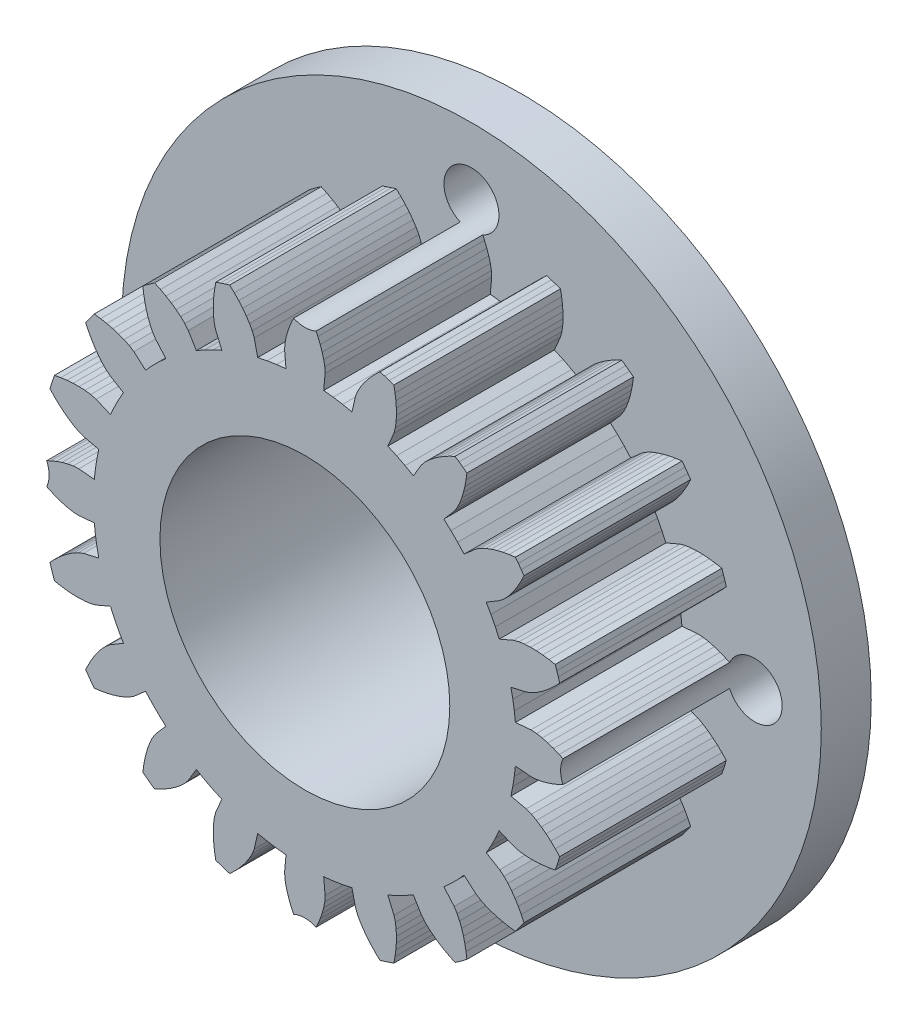
from build123d import *

# Parameters (mm, degrees)
SUN_TEETH_START     = 30
SKETCH_1_R          = 8.7
SUN_TEETH_DEPTH     = 10
SUN_FLANGE_START    = 27
SKETCH_2_R          = 21
SKETCH_2_R_2        = 8.7
SUN_FLANGE_DEPTH    = 3
SKETCH_3_R          = 1.65
THROUGH_HOLES_DEPTH = 100


with BuildPart() as part:
    # Эскиз1 → Sun_teeth (new body)
    with BuildSketch(Plane.XY.offset(SUN_TEETH_START)):
        Polygon((12.636938344, -1.131567732), (13.571243099, -1.21522954), (13.90631459, -1.195509775), (14.24468064, -1.133068514), (14.584638429, -1.040946263), (14.925265343, -0.923424492), (15.265811742, -0.782812918), (15.605600595, -0.620576184), (15.943992279, -0.437733022), (15.949332438, -0.145927294), (15.949332438, 0.145927294), (15.943992279, 0.437733022), (15.605600595, 0.620576184), (15.265811742, 0.782812918), (14.925265343, 0.923424492), (14.584638429, 1.040946263), (14.24468064, 1.133068514), (13.90631459, 1.195509775), (13.571243099, 1.21522954), (12.636938344, 1.131567732), (12.57293242, 1.701183884), (12.483264038, 2.267327769), (12.368116218, 2.82884384), (13.282545763, 3.037992779), (13.595123946, 3.160290176), (13.897633772, 3.324236204), (14.192485501, 3.516902405), (14.480124723, 3.733931756), (14.760552229, 3.972895934), (15.033576724, 4.232192768), (15.298904696, 4.51065573), (15.21381056, 4.789829669), (15.123622532, 5.067399876), (15.02837081, 5.343273415), (14.65003955, 5.412598815), (14.276747238, 5.461894588), (13.909417001, 5.490389517), (13.54914533, 5.496899858), (13.197358919, 5.479460591), (12.856258271, 5.434284899), (12.531492603, 5.349496726), (11.668768899, 4.981213571), (11.431874577, 5.503171805), (11.171646795, 6.013897582), (10.888616702, 6.512348467), (11.693660304, 6.993835198), (11.953147847, 7.206738905), (12.19018968, 7.456141521), (12.411073208, 7.730492162), (12.617568607, 8.025784748), (12.810427021, 8.339710052), (12.989961618, 8.670685204), (13.156253727, 9.017510071), (12.989054903, 9.256724731), (12.81750708, 9.492840052), (12.641667697, 9.725776978), (12.26043056, 9.674798562), (11.890175244, 9.60632796), (11.53201801, 9.519916963), (11.187367484, 9.414778596), (10.858187755, 9.289484888), (10.547741818, 9.141114354), (10.2650723, 8.960117899), (9.558379052, 8.343263519), (9.171785199, 8.766470927), (8.766470927, 9.171785199), (8.343263519, 9.558379052), (8.960117899, 10.2650723), (9.141114354, 10.547741818), (9.289484888, 10.858187755), (9.414778596, 11.187367484), (9.519916963, 11.53201801), (9.60632796, 11.890175244), (9.674798562, 12.26043056), (9.725776978, 12.641667697), (9.492840052, 12.81750708), (9.256724731, 12.989054903), (9.017510071, 13.156253727), (8.670685204, 12.989961618), (8.339710052, 12.810427021), (8.025784748, 12.617568607), (7.730492162, 12.411073208), (7.456141521, 12.19018968), (7.206738905, 11.953147847), (6.993835198, 11.693660304), (6.512348467, 10.888616702), (6.013897582, 11.171646795), (5.503171805, 11.431874577), (4.981213571, 11.668768899), (5.349496726, 12.531492603), (5.434284899, 12.856258271), (5.479460591, 13.197358919), (5.496899858, 13.54914533), (5.490389517, 13.909417001), (5.461894588, 14.276747238), (5.412598815, 14.65003955), (5.343273415, 15.02837081), (5.067399876, 15.123622532), (4.789829669, 15.21381056), (4.51065573, 15.298904696), (4.232192768, 15.033576724), (3.972895934, 14.760552229), (3.733931756, 14.480124723), (3.516902405, 14.192485501), (3.324236204, 13.897633772), (3.160290176, 13.595123946), (3.037992779, 13.282545763), (2.82884384, 12.368116218), (2.267327769, 12.483264038), (1.701183884, 12.57293242), (1.131567732, 12.636938344), (1.21522954, 13.571243099), (1.195509775, 13.90631459), (1.133068514, 14.24468064), (1.040946263, 14.584638429), (0.923424492, 14.925265343), (0.782812918, 15.265811742), (0.620576184, 15.605600595), (0.437733022, 15.943992279), (0.145927294, 15.949332438), (-0.145927294, 15.949332438), (-0.437733022, 15.943992279), (-0.620576184, 15.605600595), (-0.782812918, 15.265811742), (-0.923424492, 14.925265343), (-1.040946263, 14.584638429), (-1.133068514, 14.24468064), (-1.195509775, 13.90631459), (-1.21522954, 13.571243099), (-1.131567732, 12.636938344), (-1.701183884, 12.57293242), (-2.267327769, 12.483264038), (-2.82884384, 12.368116218), (-3.037992779, 13.282545763), (-3.160290176, 13.595123946), (-3.324236204, 13.897633772), (-3.516902405, 14.192485501), (-3.733931756, 14.480124723), (-3.972895934, 14.760552229), (-4.232192768, 15.033576724), (-4.51065573, 15.298904696), (-4.789829669, 15.21381056), (-5.067399876, 15.123622532), (-5.343273415, 15.02837081), (-5.412598815, 14.65003955), (-5.461894588, 14.276747238), (-5.490389517, 13.909417001), (-5.496899858, 13.54914533), (-5.479460591, 13.197358919), (-5.434284899, 12.856258271), (-5.349496726, 12.531492603), (-4.981213571, 11.668768899), (-5.503171805, 11.431874577), (-6.013897582, 11.171646795), (-6.512348467, 10.888616702), (-6.993835198, 11.693660304), (-7.206738905, 11.953147847), (-7.456141521, 12.19018968), (-7.730492162, 12.411073208), (-8.025784748, 12.617568607), (-8.339710052, 12.810427021), (-8.670685204, 12.989961618), (-9.017510071, 13.156253727), (-9.256724731, 12.989054903), (-9.492840052, 12.81750708), (-9.725776978, 12.641667697), (-9.674798562, 12.26043056), (-9.60632796, 11.890175244), (-9.519916963, 11.53201801), (-9.414778596, 11.187367484), (-9.289484888, 10.858187755), (-9.141114354, 10.547741818), (-8.960117899, 10.2650723), (-8.343263519, 9.558379052), (-8.766470927, 9.171785199), (-9.171785199, 8.766470927), (-9.558379052, 8.343263519), (-10.2650723, 8.960117899), (-10.547741818, 9.141114354), (-10.858187755, 9.289484888), (-11.187367484, 9.414778596), (-11.53201801, 9.519916963), (-11.890175244, 9.60632796), (-12.26043056, 9.674798562), (-12.641667697, 9.725776978), (-12.81750708, 9.492840052), (-12.989054903, 9.256724731), (-13.156253727, 9.017510071), (-12.989961618, 8.670685204), (-12.810427021, 8.339710052), (-12.617568607, 8.025784748), (-12.411073208, 7.730492162), (-12.19018968, 7.456141521), (-11.953147847, 7.206738905), (-11.693660304, 6.993835198), (-10.888616702, 6.512348467), (-11.171646795, 6.013897582), (-11.431874577, 5.503171805), (-11.668768899, 4.981213571), (-12.531492603, 5.349496726), (-12.856258271, 5.434284899), (-13.197358919, 5.479460591), (-13.54914533, 5.496899858), (-13.909417001, 5.490389517), (-14.276747238, 5.461894588), (-14.65003955, 5.412598815), (-15.02837081, 5.343273415), (-15.123622532, 5.067399876), (-15.21381056, 4.789829669), (-15.298904696, 4.51065573), (-15.033576724, 4.232192768), (-14.760552229, 3.972895934), (-14.480124723, 3.733931756), (-14.192485501, 3.516902405), (-13.897633772, 3.324236204), (-13.595123946, 3.160290176), (-13.282545763, 3.037992779), (-12.368116218, 2.82884384), (-12.483264038, 2.267327769), (-12.57293242, 1.701183884), (-12.636938344, 1.131567732), (-13.571243099, 1.21522954), (-13.90631459, 1.195509775), (-14.24468064, 1.133068514), (-14.584638429, 1.040946263), (-14.925265343, 0.923424492), (-15.265811742, 0.782812918), (-15.605600595, 0.620576184), (-15.943992279, 0.437733022), (-15.949332438, 0.145927294), (-15.949332438, -0.145927294), (-15.943992279, -0.437733022), (-15.605600595, -0.620576184), (-15.265811742, -0.782812918), (-14.925265343, -0.923424492), (-14.584638429, -1.040946263), (-14.24468064, -1.133068514), (-13.90631459, -1.195509775), (-13.571243099, -1.21522954), (-12.636938344, -1.131567732), (-12.57293242, -1.701183884), (-12.483264038, -2.267327769), (-12.368116218, -2.82884384), (-13.282545763, -3.037992779), (-13.595123946, -3.160290176), (-13.897633772, -3.324236204), (-14.192485501, -3.516902405), (-14.480124723, -3.733931756), (-14.760552229, -3.972895934), (-15.033576724, -4.232192768), (-15.298904696, -4.51065573), (-15.21381056, -4.789829669), (-15.123622532, -5.067399876), (-15.02837081, -5.343273415), (-14.65003955, -5.412598815), (-14.276747238, -5.461894588), (-13.909417001, -5.490389517), (-13.54914533, -5.496899858), (-13.197358919, -5.479460591), (-12.856258271, -5.434284899), (-12.531492603, -5.349496726), (-11.668768899, -4.981213571), (-11.431874577, -5.503171805), (-11.171646795, -6.013897582), (-10.888616702, -6.512348467), (-11.693660304, -6.993835198), (-11.953147847, -7.206738905), (-12.19018968, -7.456141521), (-12.411073208, -7.730492162), (-12.617568607, -8.025784748), (-12.810427021, -8.339710052), (-12.989961618, -8.670685204), (-13.156253727, -9.017510071), (-12.989054903, -9.256724731), (-12.81750708, -9.492840052), (-12.641667697, -9.725776978), (-12.26043056, -9.674798562), (-11.890175244, -9.60632796), (-11.53201801, -9.519916963), (-11.187367484, -9.414778596), (-10.858187755, -9.289484888), (-10.547741818, -9.141114354), (-10.2650723, -8.960117899), (-9.558379052, -8.343263519), (-9.171785199, -8.766470927), (-8.766470927, -9.171785199), (-8.343263519, -9.558379052), (-8.960117899, -10.2650723), (-9.141114354, -10.547741818), (-9.289484888, -10.858187755), (-9.414778596, -11.187367484), (-9.519916963, -11.53201801), (-9.60632796, -11.890175244), (-9.674798562, -12.26043056), (-9.725776978, -12.641667697), (-9.492840052, -12.81750708), (-9.256724731, -12.989054903), (-9.017510071, -13.156253727), (-8.670685204, -12.989961618), (-8.339710052, -12.810427021), (-8.025784748, -12.617568607), (-7.730492162, -12.411073208), (-7.456141521, -12.19018968), (-7.206738905, -11.953147847), (-6.993835198, -11.693660304), (-6.512348467, -10.888616702), (-6.013897582, -11.171646795), (-5.503171805, -11.431874577), (-4.981213571, -11.668768899), (-5.349496726, -12.531492603), (-5.434284899, -12.856258271), (-5.479460591, -13.197358919), (-5.496899858, -13.54914533), (-5.490389517, -13.909417001), (-5.461894588, -14.276747238), (-5.412598815, -14.65003955), (-5.343273415, -15.02837081), (-5.067399876, -15.123622532), (-4.789829669, -15.21381056), (-4.51065573, -15.298904696), (-4.232192768, -15.033576724), (-3.972895934, -14.760552229), (-3.733931756, -14.480124723), (-3.516902405, -14.192485501), (-3.324236204, -13.897633772), (-3.160290176, -13.595123946), (-3.037992779, -13.282545763), (-2.82884384, -12.368116218), (-2.267327769, -12.483264038), (-1.701183884, -12.57293242), (-1.131567732, -12.636938344), (-1.21522954, -13.571243099), (-1.195509775, -13.90631459), (-1.133068514, -14.24468064), (-1.040946263, -14.584638429), (-0.923424492, -14.925265343), (-0.782812918, -15.265811742), (-0.620576184, -15.605600595), (-0.437733022, -15.943992279), (-0.145927294, -15.949332438), (0.145927294, -15.949332438), (0.437733022, -15.943992279), (0.620576184, -15.605600595), (0.782812918, -15.265811742), (0.923424492, -14.925265343), (1.040946263, -14.584638429), (1.133068514, -14.24468064), (1.195509775, -13.90631459), (1.21522954, -13.571243099), (1.131567732, -12.636938344), (1.701183884, -12.57293242), (2.267327769, -12.483264038), (2.82884384, -12.368116218), (3.037992779, -13.282545763), (3.160290176, -13.595123946), (3.324236204, -13.897633772), (3.516902405, -14.192485501), (3.733931756, -14.480124723), (3.972895934, -14.760552229), (4.232192768, -15.033576724), (4.51065573, -15.298904696), (4.789829669, -15.21381056), (5.067399876, -15.123622532), (5.343273415, -15.02837081), (5.412598815, -14.65003955), (5.461894588, -14.276747238), (5.490389517, -13.909417001), (5.496899858, -13.54914533), (5.479460591, -13.197358919), (5.434284899, -12.856258271), (5.349496726, -12.531492603), (4.981213571, -11.668768899), (5.503171805, -11.431874577), (6.013897582, -11.171646795), (6.512348467, -10.888616702), (6.993835198, -11.693660304), (7.206738905, -11.953147847), (7.456141521, -12.19018968), (7.730492162, -12.411073208), (8.025784748, -12.617568607), (8.339710052, -12.810427021), (8.670685204, -12.989961618), (9.017510071, -13.156253727), (9.256724731, -12.989054903), (9.492840052, -12.81750708), (9.725776978, -12.641667697), (9.674798562, -12.26043056), (9.60632796, -11.890175244), (9.519916963, -11.53201801), (9.414778596, -11.187367484), (9.289484888, -10.858187755), (9.141114354, -10.547741818), (8.960117899, -10.2650723), (8.343263519, -9.558379052), (8.766470927, -9.171785199), (9.171785199, -8.766470927), (9.558379052, -8.343263519), (10.2650723, -8.960117899), (10.547741818, -9.141114354), (10.858187755, -9.289484888), (11.187367484, -9.414778596), (11.53201801, -9.519916963), (11.890175244, -9.60632796), (12.26043056, -9.674798562), (12.641667697, -9.725776978), (12.81750708, -9.492840052), (12.989054903, -9.256724731), (13.156253727, -9.017510071), (12.989961618, -8.670685204), (12.810427021, -8.339710052), (12.617568607, -8.025784748), (12.411073208, -7.730492162), (12.19018968, -7.456141521), (11.953147847, -7.206738905), (11.693660304, -6.993835198), (10.888616702, -6.512348467), (11.171646795, -6.013897582), (11.431874577, -5.503171805), (11.668768899, -4.981213571), (12.531492603, -5.349496726), (12.856258271, -5.434284899), (13.197358919, -5.479460591), (13.54914533, -5.496899858), (13.909417001, -5.490389517), (14.276747238, -5.461894588), (14.65003955, -5.412598815), (15.02837081, -5.343273415), (15.123622532, -5.067399876), (15.21381056, -4.789829669), (15.298904696, -4.51065573), (15.033576724, -4.232192768), (14.760552229, -3.972895934), (14.480124723, -3.733931756), (14.192485501, -3.516902405), (13.897633772, -3.324236204), (13.595123946, -3.160290176), (13.282545763, -3.037992779), (12.368116218, -2.82884384), (12.483264038, -2.267327769), (12.57293242, -1.701183884), align=None)
        Circle(SKETCH_1_R, mode=Mode.SUBTRACT)
    extrude(amount=SUN_TEETH_DEPTH)

    # Эскиз2 → Sun_flange (add)
    with BuildSketch(Plane.XY.offset(SUN_FLANGE_START)):
        Circle(SKETCH_2_R)
        Circle(SKETCH_2_R_2, mode=Mode.SUBTRACT)
    extrude(amount=SUN_FLANGE_DEPTH)

    # Эскиз3 → Through_holes (cut, symmetric)
    with BuildSketch(Plane.XY):
        with Locations((17, 0)):
            Circle(SKETCH_3_R)
        with Locations((0, 17)):
            Circle(SKETCH_3_R)
        with Locations((-17, 0)):
            Circle(SKETCH_3_R)
        with Locations((0, -17)):
            Circle(SKETCH_3_R)
    extrude(amount=THROUGH_HOLES_DEPTH, both=True, mode=Mode.SUBTRACT)


solid = part.part
